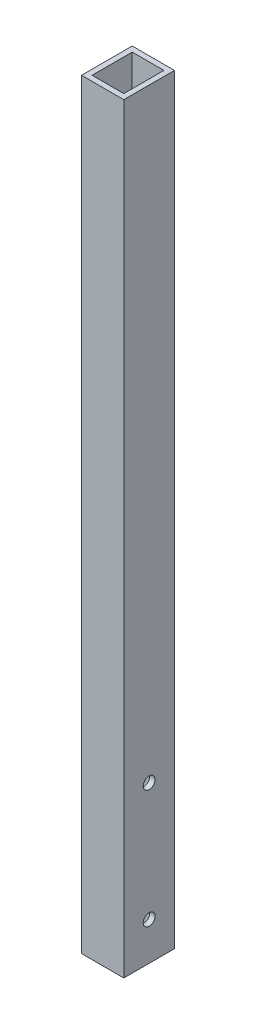
from build123d import *

# Parameters (mm, degrees)
SKETCH1_W           = 63.5
SKETCH1_H           = 76.2
BOSS_EXTRUDE1_DEPTH = 1143
SKETCH2_W           = 47.625
SKETCH2_H           = 60.325
CUT_EXTRUDE1_DEPTH  = 1145.075466261
SKETCH3_R           = 8.89
CUT_EXTRUDE2_DEPTH  = 1146.396376806


with BuildPart() as part:
    # Sketch1 → Boss-Extrude1 (new body)
    with BuildSketch(Plane(origin=(0, 0, 0), x_dir=(1, 0, 0), z_dir=(0, 1, 0))):
        Rectangle(SKETCH1_W, SKETCH1_H)
    extrude(amount=-BOSS_EXTRUDE1_DEPTH)

    # Sketch2 → Cut-Extrude1 (cut, through all)
    with BuildSketch(Plane.XZ.offset(1143)):
        Rectangle(SKETCH2_W, SKETCH2_H)
    extrude(amount=-CUT_EXTRUDE1_DEPTH, mode=Mode.SUBTRACT)

    # Sketch3 → Cut-Extrude2 (cut, through all)
    with BuildSketch(Plane.ZY.offset(31.75)):
        with Locations((0, -908.05)):
            Circle(SKETCH3_R)
        with Locations((0, -1085.85)):
            Circle(SKETCH3_R)
    extrude(amount=-CUT_EXTRUDE2_DEPTH, mode=Mode.SUBTRACT)


solid = part.part
